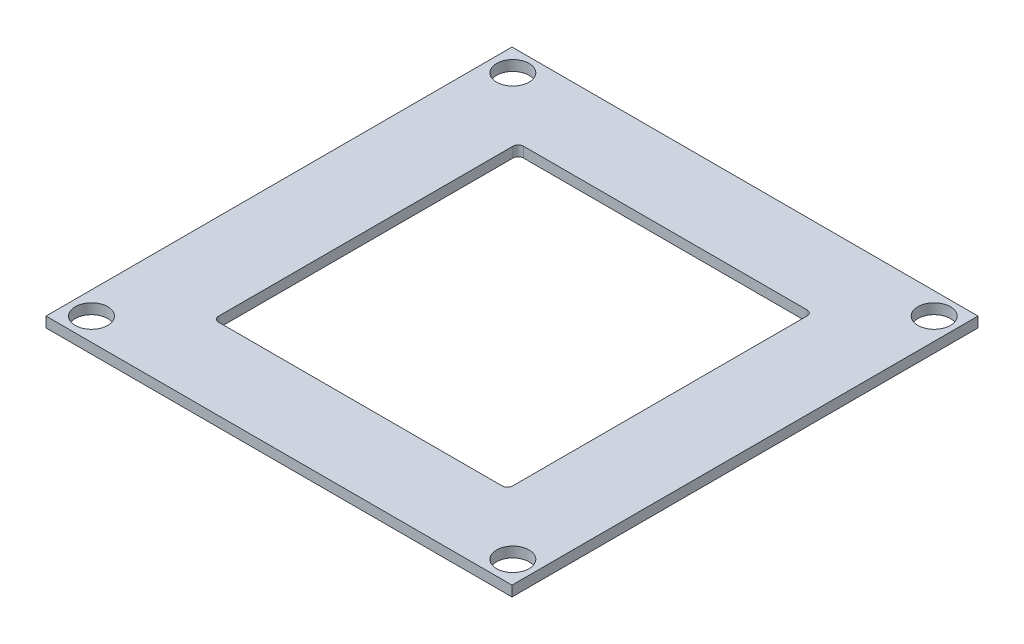
from build123d import *

# Parameters (mm, degrees)
SKETCH1_W           = 286.791999948
SKETCH1_H           = 286.791999948
BOSS_EXTRUDE1_DEPTH = 6.35
SKETCH2_R           = 10
SKETCH2_W           = 180.979932016
SKETCH2_H           = 187.647432016
CUT_EXTRUDE1_DEPTH  = 6.35
FILLET1_R           = 3.175


with BuildPart() as part:
    # Sketch1 → Boss-Extrude1 (new body)
    with BuildSketch(Plane(origin=(0, 0, 0), x_dir=(1, 0, 0), z_dir=(0, 1, 0))):
        with Locations((143.395999974, 0)):
            Rectangle(SKETCH1_W, SKETCH1_H)
    extrude(amount=BOSS_EXTRUDE1_DEPTH)

    # Sketch2 → Cut-Extrude1 (cut)
    with BuildSketch(Plane.XZ):
        with Locations(Location((273.299999948, -129.903999974, 0), (0, 0, 270))):
            Circle(SKETCH2_R)
        with Locations(Location((14, -129.903999974, 0), (0, 0, 270))):
            Circle(SKETCH2_R)
        with Locations(Location((14, 129.395999974, 0), (0, 0, 270))):
            Circle(SKETCH2_R)
        with Locations(Location((273.299999948, 129.395999974, 0), (0, 0, 270))):
            Circle(SKETCH2_R)
        with Locations((143.649999974, -0.254)):
            Rectangle(SKETCH2_W, SKETCH2_H)
    extrude(amount=-CUT_EXTRUDE1_DEPTH, mode=Mode.SUBTRACT)

    # Fillet1
    fillet1_edges = [part.edges().sort_by_distance(p)[0] for p in [
        (53.160033966, 3.175, -94.077716008),
        (53.160033966, 3.175, 93.569716008),
        (234.139965982, 3.175, 93.569716008),
        (234.139965982, 3.175, -94.077716008),
    ]]
    fillet(fillet1_edges, radius=FILLET1_R)


solid = part.part
